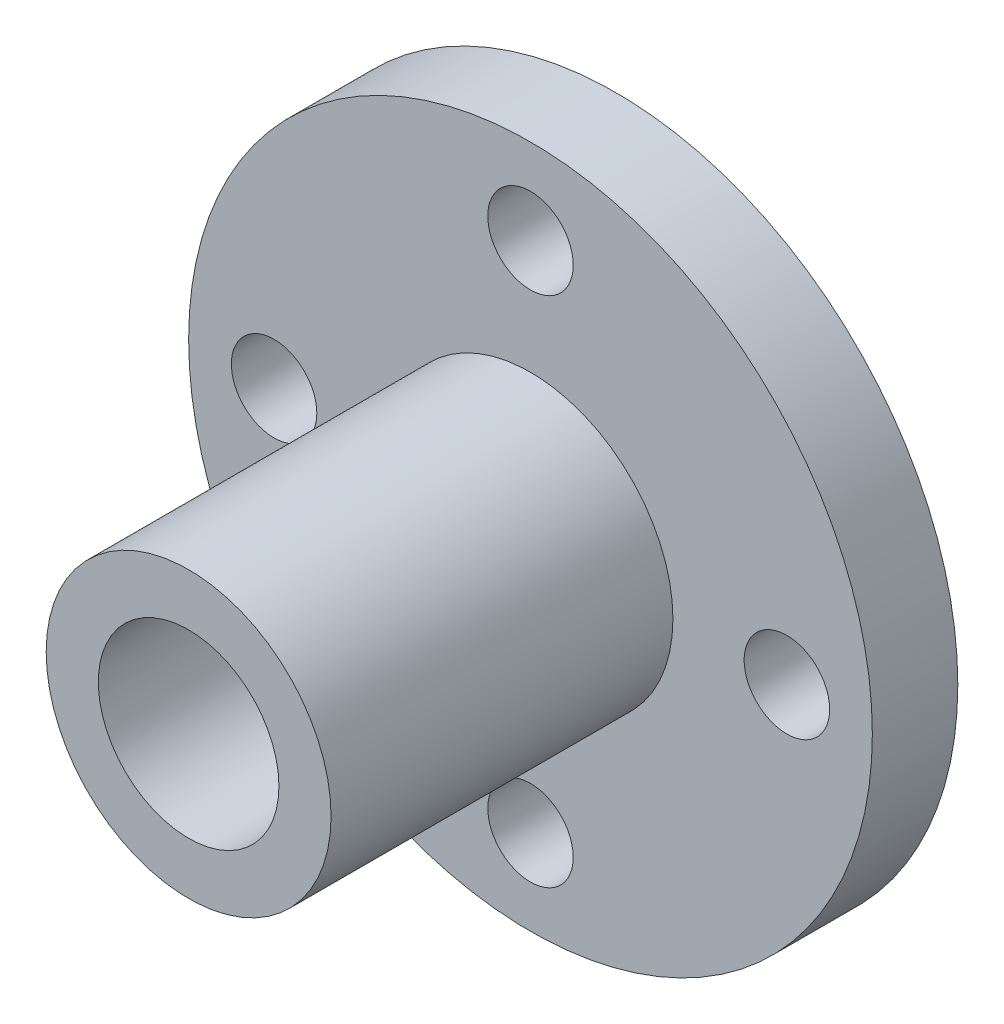
from build123d import *

# Parameters (mm, degrees)
SKETCH1_R           = 12
BOSS_EXTRUDE1_DEPTH = 3
SKETCH2_R           = 5
BOSS_EXTRUDE2_DEPTH = 15
SKETCH3_R           = 3.17
CUT_EXTRUDE1_DEPTH  = 15
SKETCH4_R           = 1.5
CUT_EXTRUDE2_DEPTH  = 5


with BuildPart() as part:
    # Sketch1 → Boss-Extrude1 (new body)
    with BuildSketch(Plane.XY):
        Circle(SKETCH1_R)
    extrude(amount=BOSS_EXTRUDE1_DEPTH)

    # Sketch2 → Boss-Extrude2 (add)
    with BuildSketch(Plane.XY):
        Circle(SKETCH2_R)
    extrude(amount=BOSS_EXTRUDE2_DEPTH)

    # Sketch3 → Cut-Extrude1 (cut)
    with BuildSketch(Plane.XY):
        Circle(SKETCH3_R)
    extrude(amount=CUT_EXTRUDE1_DEPTH, mode=Mode.SUBTRACT)

    # Sketch4 → Cut-Extrude2 (cut)
    with BuildSketch(Plane.XY):
        with Locations((-9, 0)):
            Circle(SKETCH4_R)
        with Locations((0, 9)):
            Circle(SKETCH4_R)
        with Locations((9, 0)):
            Circle(SKETCH4_R)
        with Locations((0, -9)):
            Circle(SKETCH4_R)
    extrude(amount=CUT_EXTRUDE2_DEPTH, mode=Mode.SUBTRACT)


solid = part.part
